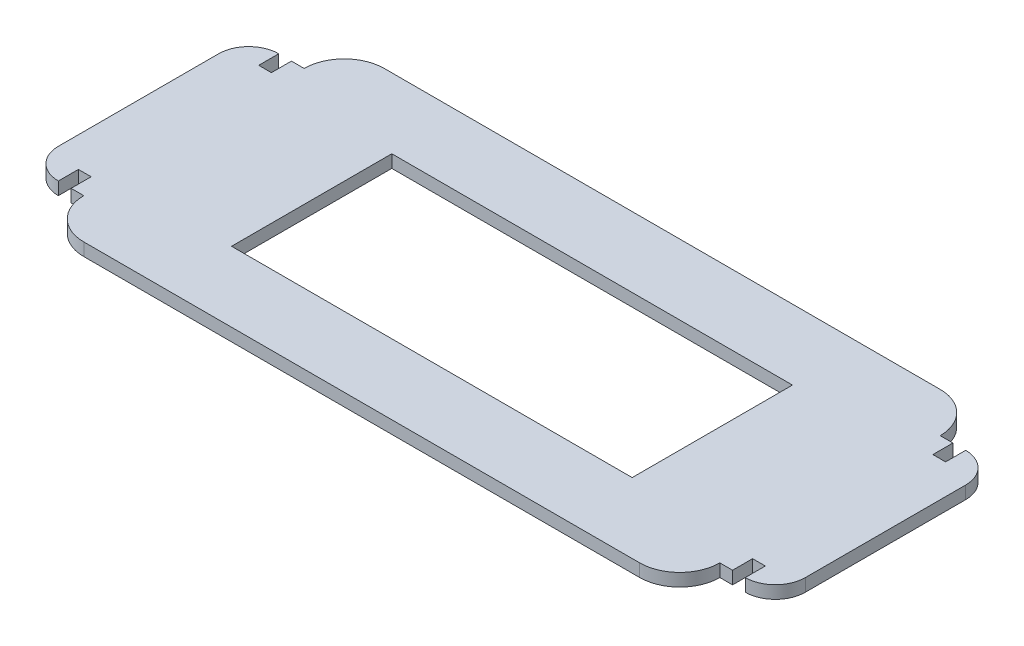
from build123d import *

# Parameters (mm, degrees)
SKETCH1_W           = 100
SKETCH1_H           = 40
BOSS_EXTRUDE2_DEPTH = 3.175


with BuildPart() as part:
    # Sketch1 → Boss-Extrude2 (new body)
    with BuildSketch(Plane(origin=(0, 0, 0), x_dir=(1, 0, 0), z_dir=(0, 1, 0))):
        with BuildLine():
            Line((-69.375, 37.5), (69.375, 37.5))
            ThreePointArc((69.375, 37.5), (76.446067812, 34.571067812), (79.375, 27.5))
            Line((79.375, 27.5), (82.55, 27.5))
            Line((82.55, 27.5), (82.55, 22.5))
            Line((82.55, 22.5), (85.725, 22.5))
            Line((85.725, 22.5), (85.725, 27.5))
            ThreePointArc((85.725, 27.5), (91.028300859, 25.303300859), (93.225, 20))
            Line((93.225, 20), (93.225, -20))
            ThreePointArc((93.225, -20), (91.028300859, -25.303300859), (85.725, -27.5))
            Line((85.725, -27.5), (85.725, -22.5))
            Line((85.725, -22.5), (82.55, -22.5))
            Line((82.55, -22.5), (82.55, -27.5))
            Line((82.55, -27.5), (79.375, -27.5))
            ThreePointArc((79.375, -27.5), (76.446067812, -34.571067812), (69.375, -37.5))
            Line((69.375, -37.5), (-69.375, -37.5))
            ThreePointArc((-69.375, -37.5), (-76.446067812, -34.571067812), (-79.375, -27.5))
            Line((-79.375, -27.5), (-82.55, -27.5))
            Line((-82.55, -27.5), (-82.55, -22.5))
            Line((-82.55, -22.5), (-85.725, -22.5))
            Line((-85.725, -22.5), (-85.725, -27.5))
            ThreePointArc((-85.725, -27.5), (-91.028300859, -25.303300859), (-93.225, -20))
            Line((-93.225, -20), (-93.225, 20))
            ThreePointArc((-93.225, 20), (-91.028300859, 25.303300859), (-85.725, 27.5))
            Line((-85.725, 27.5), (-85.725, 22.5))
            Line((-85.725, 22.5), (-82.55, 22.5))
            Line((-82.55, 22.5), (-82.55, 27.5))
            Line((-82.55, 27.5), (-79.375, 27.5))
            ThreePointArc((-79.375, 27.5), (-76.446067812, 34.571067812), (-69.375, 37.5))
        make_face()
        Rectangle(SKETCH1_W, SKETCH1_H, mode=Mode.SUBTRACT)
    extrude(amount=BOSS_EXTRUDE2_DEPTH)


solid = part.part
